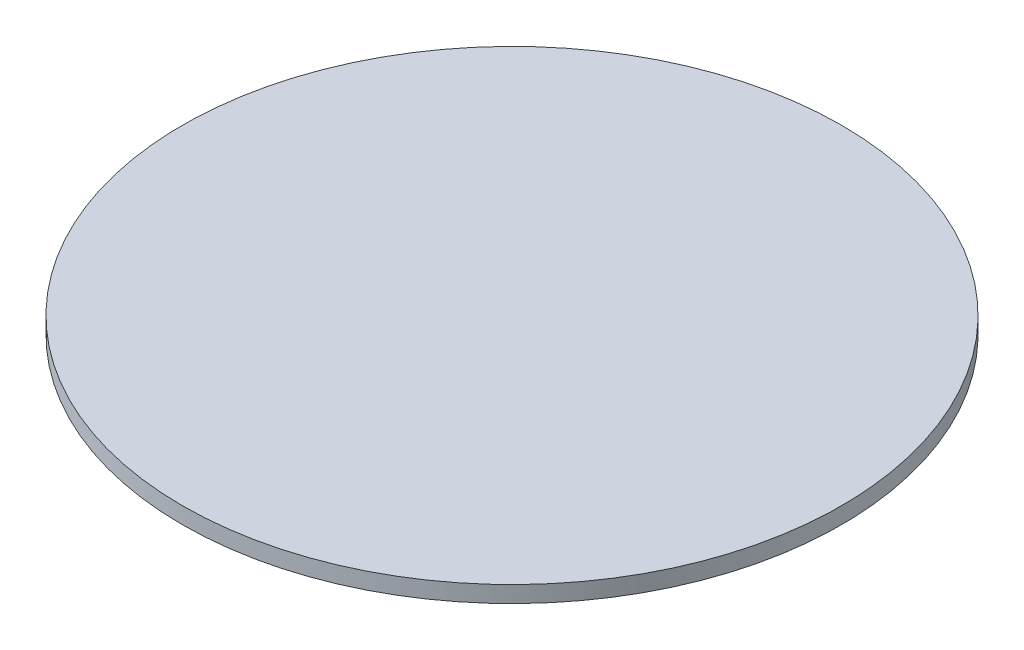
from build123d import *

# Parameters (mm, degrees)
SKETCH_1_R      = 20
EXTRUDE_1_DEPTH = 1


with BuildPart() as part:
    # 草图1 → 凸台-拉伸1 (new body)
    with BuildSketch(Plane(origin=(0, 0, 0), x_dir=(1, 0, 0), z_dir=(0, 1, 0))):
        with Locations(Location((0, 0, 0), (0, 0, 270))):
            Circle(SKETCH_1_R)
    extrude(amount=EXTRUDE_1_DEPTH)


solid = part.part
